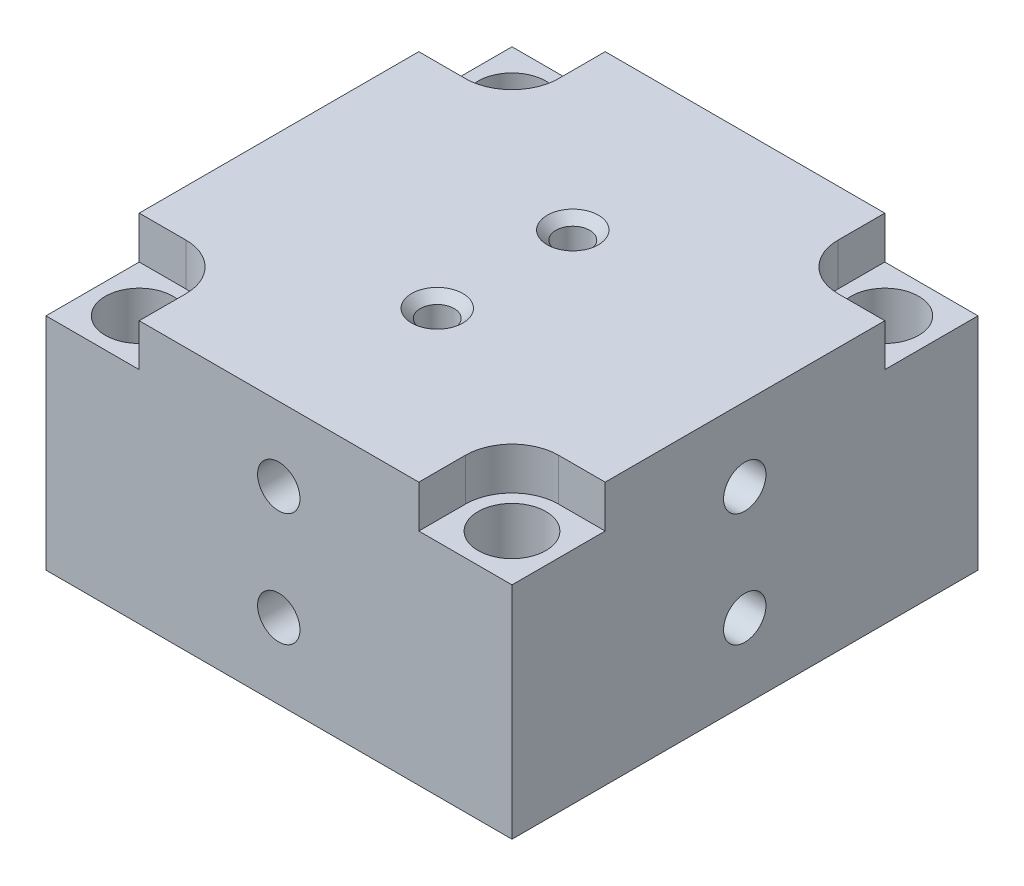
from build123d import *

# Parameters (mm, degrees)
SKETCH_1_W                   = 55
SKETCH_1_H                   = 55
EXTRUDE_1_DEPTH              = 15.5
CUT_EXTRUDE_1_DEPTH          = 5
SKETCH_4_R                   = 4
CUT_EXTRUDE_2_DEPTH          = 47.781406563
PATTERN_LINEAR_3_COUNT       = 2
PATTERN_LINEAR_3_PITCH       = 16
PATTERN_LINEAR_4_COUNT       = 2
PATTERN_LINEAR_4_PITCH       = 13.4
PATTERN_CIRCULAR_2_COUNT     = 4
HOLE_WIZARD_M6_3_D           = 4
HOLE_WIZARD_M6_3_DEPTH       = 7
HOLE_WIZARD_M6_3_CSINK_D     = 6.05
HOLE_WIZARD_M6_3_CSINK_ANGLE = 90
HOLE_WIZARD_M6_3_TIP         = 1.201721238


with BuildPart() as part:
    # 草图1 → 凸台-拉伸1 (new, symmetric)
    with BuildSketch(Plane(origin=(0, 0, 0), x_dir=(1, 0, 0), z_dir=(0, 1, 0))):
        Rectangle(SKETCH_1_W, SKETCH_1_H)
    extrude(amount=EXTRUDE_1_DEPTH, both=True)

    # 草图2 → 切除-拉伸1 (cut)
    with BuildSketch(Plane(origin=(0, 15.5, 0), x_dir=(1, 0, 0), z_dir=(0, 1, 0))):
        with BuildLine():
            Line((16.5, 22), (16.5, 27.5))
            Line((16.5, 27.5), (27.5, 27.5))
            Line((27.5, 27.5), (27.5, 16.5))
            Line((27.5, 16.5), (21.999999502, 16.5))
            ThreePointArc((21.999999502, 16.5), (18.110912527, 18.11091288), (16.5, 22))
        make_face()
        with BuildLine():
            Line((22, -16.5), (27.5, -16.5))
            Line((27.5, -16.5), (27.5, -27.5))
            Line((27.5, -27.5), (16.5, -27.5))
            Line((16.5, -27.5), (16.5, -21.999999502))
            ThreePointArc((16.5, -21.999999502), (18.11091288, -18.110912527), (22, -16.5))
        make_face()
        with BuildLine():
            Line((-16.5, -22), (-16.5, -27.5))
            Line((-16.5, -27.5), (-27.5, -27.5))
            Line((-27.5, -27.5), (-27.5, -16.5))
            Line((-27.5, -16.5), (-21.999999502, -16.5))
            ThreePointArc((-21.999999502, -16.5), (-18.110912527, -18.11091288), (-16.5, -22))
        make_face()
        with BuildLine():
            Line((-22, 16.5), (-27.5, 16.5))
            Line((-27.5, 16.5), (-27.5, 27.5))
            Line((-27.5, 27.5), (-16.5, 27.5))
            Line((-16.5, 27.5), (-16.5, 21.999999502))
            ThreePointArc((-16.5, 21.999999502), (-18.11091288, 18.110912527), (-22, 16.5))
        make_face()
    extrude(amount=-CUT_EXTRUDE_1_DEPTH, mode=Mode.SUBTRACT)

    # 草图4 → 切除-拉伸2 (cut, through all)
    with BuildSketch(Plane(origin=(0, 10.5, 0), x_dir=(1, 0, 0), z_dir=(0, 1, 0))):
        with Locations(Location((22, 22, 0), (0, 0, 270))):
            Circle(SKETCH_4_R)
        with Locations(Location((22, -22, 0), (0, 0, 270))):
            Circle(SKETCH_4_R)
        with Locations(Location((-22, -22, 0), (0, 0, 270))):
            Circle(SKETCH_4_R)
        with Locations(Location((-22, 22, 0), (0, 0, 270))):
            Circle(SKETCH_4_R)
    extrude(amount=-CUT_EXTRUDE_2_DEPTH, mode=Mode.SUBTRACT)

    # 草图6 → M6 螺纹孔1 (revolve, cut)
    with BuildSketch(Plane(origin=(-0.027335572, -6.601540671, 27.5), x_dir=(0, -1, 0), z_dir=(1, 0, 0))):
        Polygon((0, 0), (0, 8.502151548), (2.5, 7), (2.5, -0.5), (2, 0), align=None)
    hole_wizard_m6_1 = revolve(axis=Axis((-0.027335572, -6.601540671, 33.85), (0, 0, -1)), mode=Mode.SUBTRACT)

    # 草图8 → M6 螺纹孔2 (revolve, cut)
    with BuildSketch(Plane(origin=(-0.182583925, 15.5, -7.358132173), x_dir=(0, 0, 1), z_dir=(1, 0, 0))):
        Polygon((0, 0), (0, 8.201721238), (2, 7), (2, 1.025), (3.025, 0), align=None)
    hole_wizard_m6_2 = revolve(axis=Axis((-0.182583925, 21.85, -7.358132173), (0, -1, 0)), mode=Mode.SUBTRACT)

    # 阵列(线性)3: M6 螺纹孔2 ×2
    with Locations(*[(0, 0, i * PATTERN_LINEAR_3_PITCH) for i in range(1, PATTERN_LINEAR_3_COUNT)]):
        add(hole_wizard_m6_2, mode=Mode.SUBTRACT)

    # 阵列(线性)4: M6 螺纹孔1 ×2
    with Locations(*[(0, i * PATTERN_LINEAR_4_PITCH, 0) for i in range(1, PATTERN_LINEAR_4_COUNT)]):
        add(hole_wizard_m6_1, mode=Mode.SUBTRACT)

    # 阵列(圆周)2: M6 螺纹孔1 ×4 about axis
    pattern_circular_2_axis = Axis((0, 0, 0), (0, 1, 0))
    for i in range(1, PATTERN_CIRCULAR_2_COUNT):
        add(hole_wizard_m6_1.rotate(pattern_circular_2_axis, i * 360 / PATTERN_CIRCULAR_2_COUNT), mode=Mode.SUBTRACT)

    # 阵列(圆周)2 copy 1 sketch → 阵列(圆周)2 copy 1 (revolve, cut)
    with BuildSketch(Plane(origin=(27.5, 6.798459329, 0.027335572), x_dir=(0, -1, 0), z_dir=(0, 0, -1))):
        Polygon((0, 0), (0, 8.502151548), (2.5, 7), (2.5, -0.5), (2, 0), align=None)
    revolve(axis=Axis((33.85, 6.798459329, 0.027335572), (-1, 0, 0)), mode=Mode.SUBTRACT)

    # 阵列(圆周)2 copy 2 sketch → 阵列(圆周)2 copy 2 (revolve, cut)
    with BuildSketch(Plane(origin=(0.027335572, 6.798459329, -27.5), x_dir=(0, -1, 0), z_dir=(-1, 0, 0))):
        Polygon((0, 0), (0, 8.502151548), (2.5, 7), (2.5, -0.5), (2, 0), align=None)
    revolve(axis=Axis((0.027335572, 6.798459329, -33.85), (0, 0, 1)), mode=Mode.SUBTRACT)

    # 阵列(圆周)2 copy 3 sketch → 阵列(圆周)2 copy 3 (revolve, cut)
    with BuildSketch(Plane(origin=(-27.5, 6.798459329, -0.027335572), x_dir=(0, -1, 0), z_dir=(0, 0, 1))):
        Polygon((0, 0), (0, 8.502151548), (2.5, 7), (2.5, -0.5), (2, 0), align=None)
    revolve(axis=Axis((-33.85, 6.798459329, -0.027335572), (1, 0, 0)), mode=Mode.SUBTRACT)

    # M6 螺纹孔3
    with Locations(Plane(origin=(-6.578522575, -15.5, 8.386748618), x_dir=(-1, 0, 0), z_dir=(0, -1, 0))):
        with Locations((-6.578522575, 8.156808217)):
            CounterSinkHole(HOLE_WIZARD_M6_3_D / 2, HOLE_WIZARD_M6_3_CSINK_D / 2, depth=HOLE_WIZARD_M6_3_DEPTH, counter_sink_angle=HOLE_WIZARD_M6_3_CSINK_ANGLE)
            with Locations((0, 0, -(HOLE_WIZARD_M6_3_DEPTH + HOLE_WIZARD_M6_3_TIP / 2))):  # 118° drill point
                Cone(0, HOLE_WIZARD_M6_3_D / 2, HOLE_WIZARD_M6_3_TIP, mode=Mode.SUBTRACT)


solid = part.part
